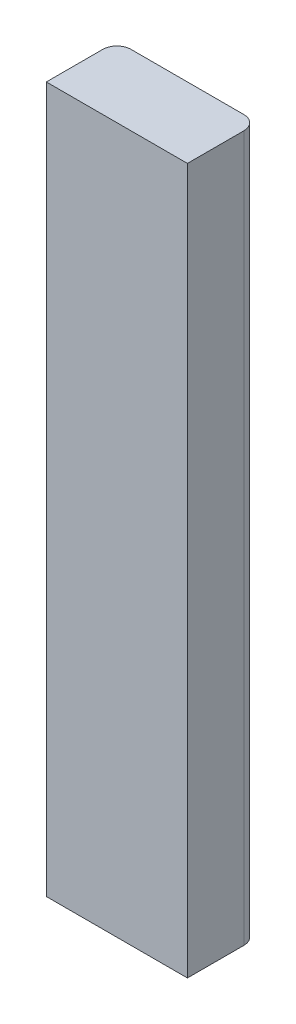
from build123d import *

# Parameters (mm, degrees)
SKETCH2_W           = 25.4
SKETCH2_H           = 12.7
BOSS_EXTRUDE2_DEPTH = 127
FILLET1_R           = 2.54


with BuildPart() as part:
    # Sketch2 → Boss-Extrude2 (new body)
    with BuildSketch(Plane(origin=(0, 0, 0), x_dir=(1, 0, 0), z_dir=(0, 1, 0))):
        with Locations((12.7, 6.35)):
            Rectangle(SKETCH2_W, SKETCH2_H)
    extrude(amount=BOSS_EXTRUDE2_DEPTH)

    # Fillet1
    fillet1_edges = [part.edges().sort_by_distance(p)[0] for p in [
        (0, 63.5, -12.7),
        (25.4, 63.5, -12.7),
    ]]
    fillet(fillet1_edges, radius=FILLET1_R)


solid = part.part
